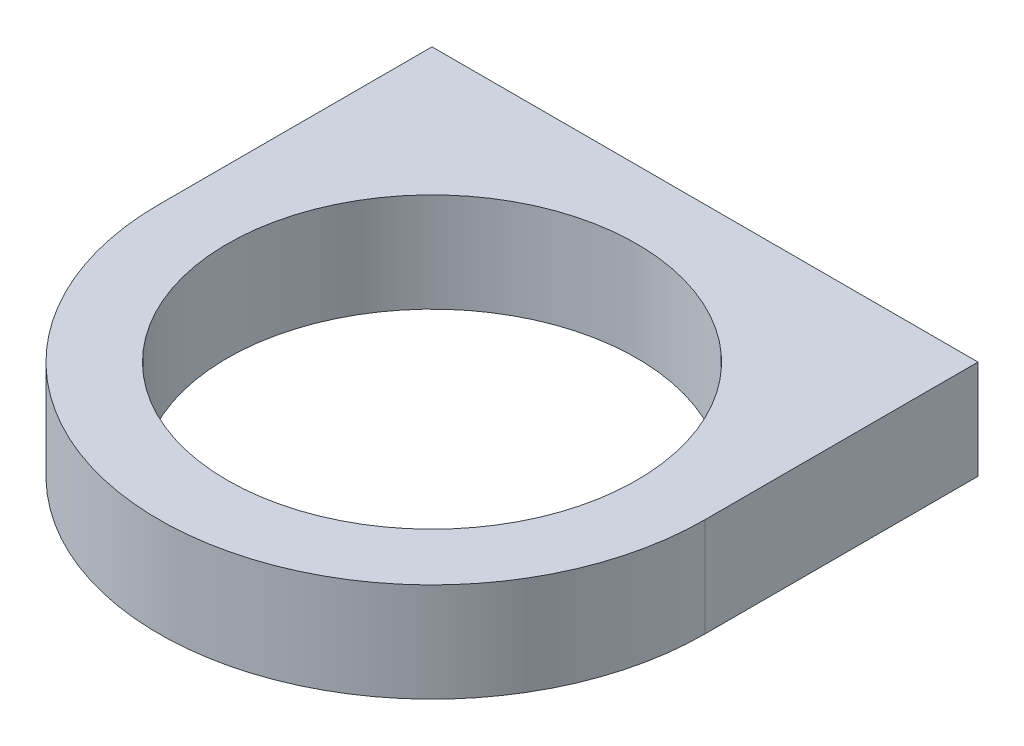
from build123d import *

# Parameters (mm, degrees)
SALIENTE_EXTRUIR1_DEPTH = 14.5
CROQUIS3_R              = 30
CORTAR_EXTRUIR1_DEPTH   = 59.39734583
CROQUIS4_R              = 1.35
CORTAR_EXTRUIR2_DEPTH   = 30


with BuildPart() as part:
    # Croquis1 → Saliente-Extruir1 (new body)
    with BuildSketch(Plane(origin=(0, 0, 0), x_dir=(1, 0, 0), z_dir=(0, 1, 0))):
        with BuildLine():
            Line((-40, 0), (-40, 40))
            Line((-40, 40), (40, 40))
            Line((40, 40), (40, 0))
            ThreePointArc((40, 0), (0, -40), (-40, 0))
        make_face()
    extrude(amount=SALIENTE_EXTRUIR1_DEPTH)

    # Croquis3 → Cortar-Extruir1 (cut, through all)
    with BuildSketch(Plane(origin=(0, 14.5, 0), x_dir=(1, 0, 0), z_dir=(0, 1, 0))):
        with Locations(Location((0, 0, 0), (0, 0, 270))):
            Circle(CROQUIS3_R)
    extrude(amount=-CORTAR_EXTRUIR1_DEPTH, mode=Mode.SUBTRACT)

    # Croquis4 → Cortar-Extruir2 (cut)
    with BuildSketch(Plane(origin=(0, 0, -40), x_dir=(-1, 0, 0), z_dir=(0, 0, -1))):
        with Locations((-35, 9.5)):
            Circle(CROQUIS4_R)
        with Locations((-35, 5)):
            Circle(CROQUIS4_R)
        with Locations((35, 9.5)):
            Circle(CROQUIS4_R)
        with Locations((35, 5)):
            Circle(CROQUIS4_R)
    extrude(amount=-CORTAR_EXTRUIR2_DEPTH, mode=Mode.SUBTRACT)


solid = part.part
